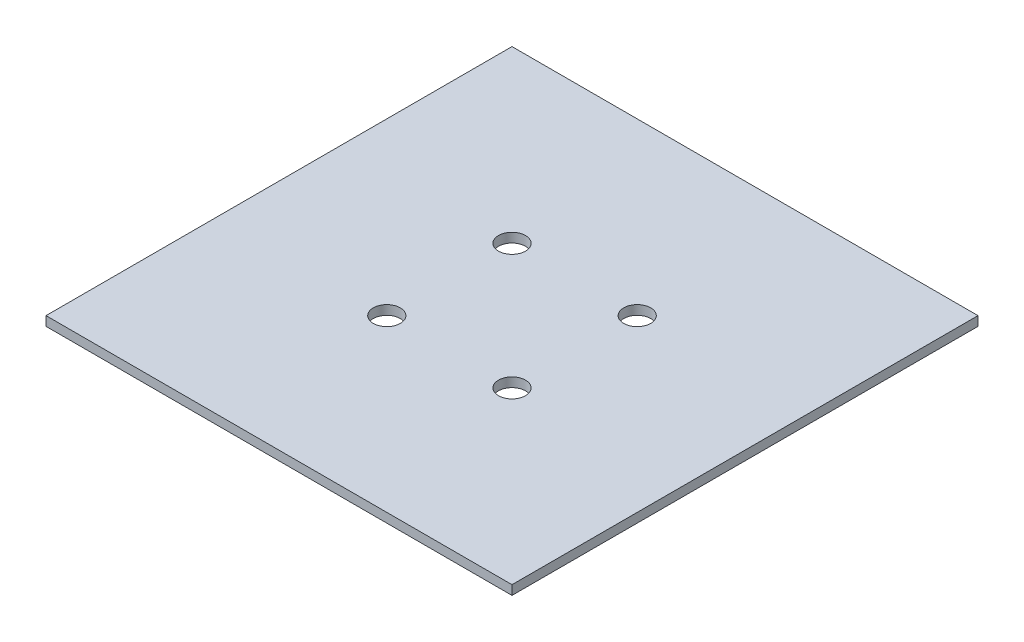
from build123d import *

# Parameters (mm, degrees)
SKETCH_1_W          = 50
SKETCH_1_H          = 50
EXTRUDE_1_DEPTH     = 1
SKETCH_3_R          = 1.45
CUT_EXTRUDE_1_DEPTH = 1


with BuildPart() as part:
    # 草图1 → 凸台-拉伸1 (new body)
    with BuildSketch(Plane(origin=(0, 0, 0), x_dir=(1, 0, 0), z_dir=(0, 1, 0))):
        Rectangle(SKETCH_1_W, SKETCH_1_H)
    extrude(amount=EXTRUDE_1_DEPTH)

    # 草图3 → 切除-拉伸1 (cut)
    with BuildSketch(Plane.XZ):
        with Locations(Location((-6.717514421, -6.717514421, 0), (0, 0, 270))):
            Circle(SKETCH_3_R)
        with Locations(Location((-6.717514421, 6.717514421, 0), (0, 0, 270))):
            Circle(SKETCH_3_R)
        with Locations(Location((6.717514421, 6.717514421, 0), (0, 0, 270))):
            Circle(SKETCH_3_R)
        with Locations(Location((6.717514421, -6.717514421, 0), (0, 0, 270))):
            Circle(SKETCH_3_R)
    extrude(amount=-CUT_EXTRUDE_1_DEPTH, mode=Mode.SUBTRACT)


solid = part.part
